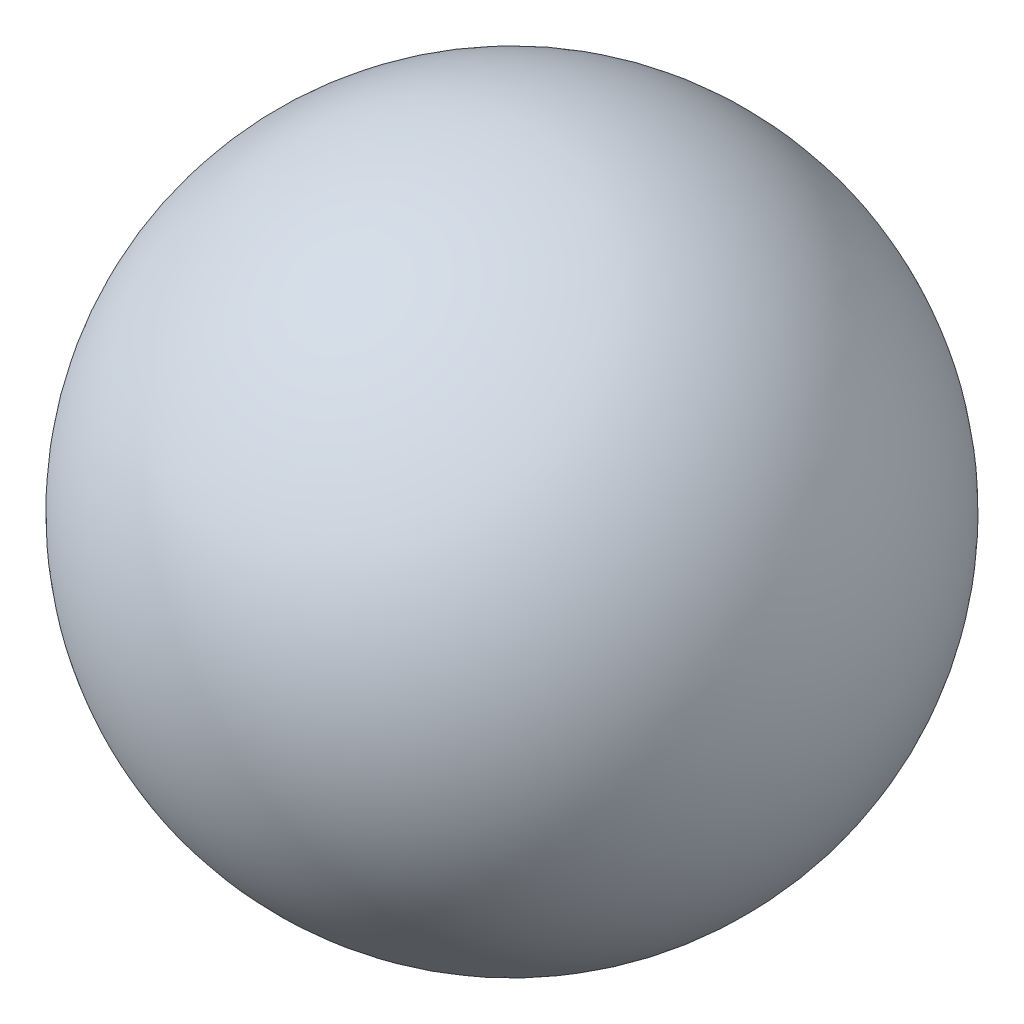
from build123d import *


with BuildPart() as part:
    # Sketch1 → Revolve5 (revolve)
    with BuildSketch(Plane(origin=(0, 0, 0), x_dir=(1, 0, 0), z_dir=(0, 1, 0))):
        with BuildLine():
            Line((0, 21.41), (0, -21.41))
            ThreePointArc((0, -21.41), (-21.41, 0), (0, 21.41))
        make_face()
    revolve(axis=Axis((0, 0, -21.41), (0, 0, 1)))


solid = part.part
